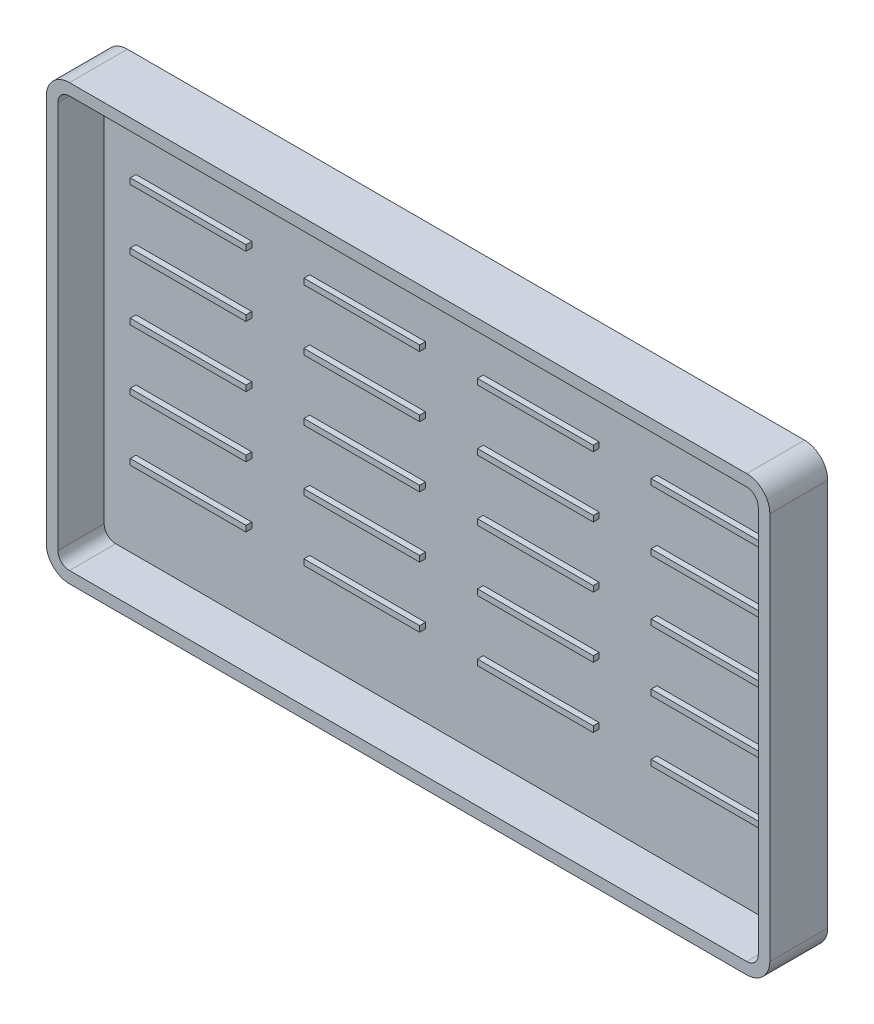
from build123d import *

# Parameters (mm, degrees)
SKETCH1_W           = 125
SKETCH1_H           = 75
BOSS_EXTRUDE1_DEPTH = 10
FILLET1_R           = 4
SHELL1_T            = -2
SKETCH2_W           = 20
SKETCH2_H           = 1
BOSS_EXTRUDE2_DEPTH = 1


with BuildPart() as part:
    # Sketch1 → Boss-Extrude1 (new body)
    with BuildSketch(Plane.XY):
        with Locations((62.5, 37.5)):
            Rectangle(SKETCH1_W, SKETCH1_H)
    extrude(amount=BOSS_EXTRUDE1_DEPTH)

    # Fillet1
    fillet1_edges = [part.edges().sort_by_distance(p)[0] for p in [
        (0, 75, 5),
        (125, 75, 5),
        (125, 0, 5),
        (0, 0, 5),
    ]]
    fillet(fillet1_edges, radius=FILLET1_R)

    # Shell1
    shell1_openings = [part.faces().sort_by_distance(p)[0] for p in [
        (62.5, 37.5, 10),
    ]]
    offset(amount=SHELL1_T, openings=shell1_openings, kind=Kind.INTERSECTION)

    # Sketch2 → Boss-Extrude2 (add)
    with BuildSketch(Plane.XY.offset(2)):
        with Locations((107.5, 58.5)):
            Rectangle(SKETCH2_W, SKETCH2_H)
        with Locations((77.5, 58.5)):
            Rectangle(SKETCH2_W, SKETCH2_H)
        with Locations((77.5, 48)):
            Rectangle(SKETCH2_W, SKETCH2_H)
        with Locations((77.5, 37.5)):
            Rectangle(SKETCH2_W, SKETCH2_H)
        with Locations((77.5, 27)):
            Rectangle(SKETCH2_W, SKETCH2_H)
        with Locations((77.5, 16.5)):
            Rectangle(SKETCH2_W, SKETCH2_H)
        with Locations((107.5, 48)):
            Rectangle(SKETCH2_W, SKETCH2_H)
        with Locations((107.5, 37.5)):
            Rectangle(SKETCH2_W, SKETCH2_H)
        with Locations((107.5, 27)):
            Rectangle(SKETCH2_W, SKETCH2_H)
        with Locations((107.5, 16.5)):
            Rectangle(SKETCH2_W, SKETCH2_H)
        with Locations((47.5, 58.5)):
            Rectangle(SKETCH2_W, SKETCH2_H)
        with Locations((47.5, 48)):
            Rectangle(SKETCH2_W, SKETCH2_H)
        with Locations((47.5, 37.5)):
            Rectangle(SKETCH2_W, SKETCH2_H)
        with Locations((47.5, 27)):
            Rectangle(SKETCH2_W, SKETCH2_H)
        with Locations((47.5, 16.5)):
            Rectangle(SKETCH2_W, SKETCH2_H)
        with Locations((17.5, 58.5)):
            Rectangle(SKETCH2_W, SKETCH2_H)
        with Locations((17.5, 48)):
            Rectangle(SKETCH2_W, SKETCH2_H)
        with Locations((17.5, 37.5)):
            Rectangle(SKETCH2_W, SKETCH2_H)
        with Locations((17.5, 27)):
            Rectangle(SKETCH2_W, SKETCH2_H)
        with Locations((17.5, 16.5)):
            Rectangle(SKETCH2_W, SKETCH2_H)
    extrude(amount=BOSS_EXTRUDE2_DEPTH)


solid = part.part
